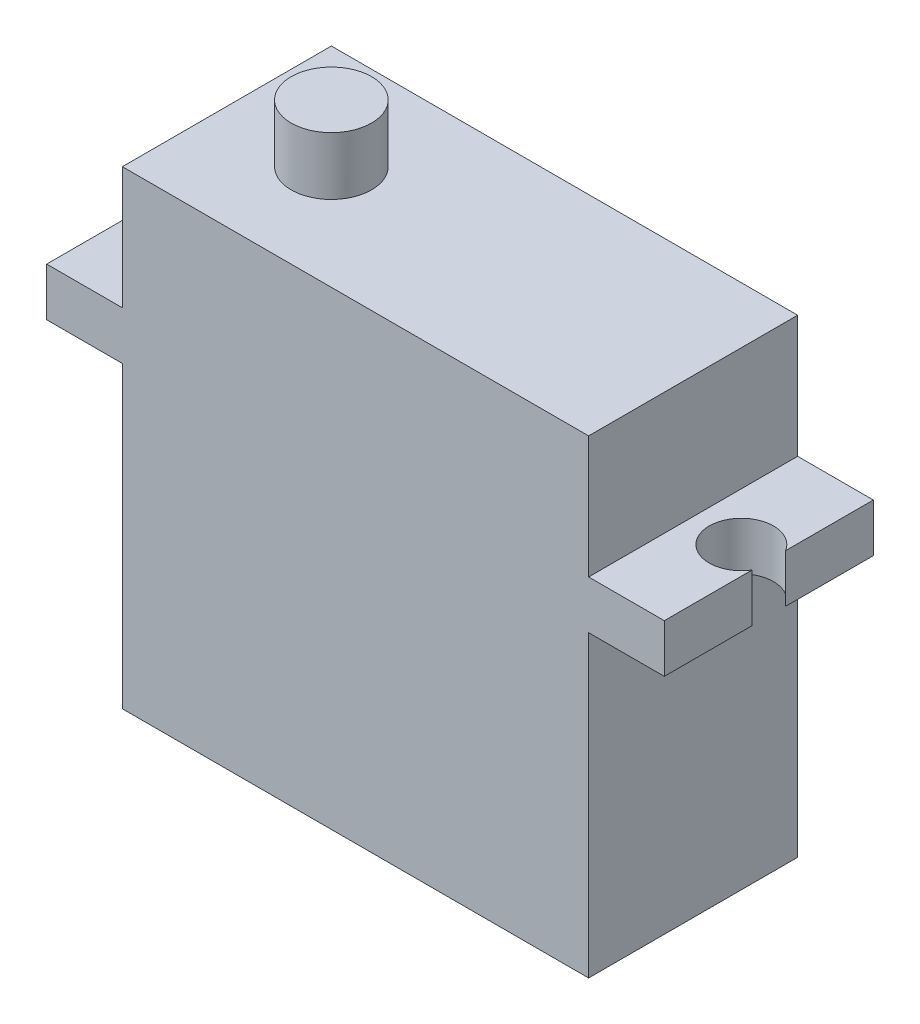
from build123d import *

# Parameters (mm, degrees)
SKETCH_1_W      = 29
SKETCH_1_H      = 13
EXTRUDE_2_DEPTH = 29.2
EXTRUDE_3_DEPTH = 3
SKETCH_3_R      = 2.5
EXTRUDE_4_DEPTH = 3.6


with BuildPart() as part:
    # 草图1 → 凸台-拉伸2 (new body)
    with BuildSketch(Plane(origin=(0, 0, 0), x_dir=(1, 0, 0), z_dir=(0, 1, 0))):
        with Locations((14.5, 6.5)):
            Rectangle(SKETCH_1_W, SKETCH_1_H)
    extrude(amount=EXTRUDE_2_DEPTH)

    # 草图2 → 凸台-拉伸3 (add)
    with BuildSketch(Plane(origin=(0, 18.6, 0), x_dir=(-1, 0, 0), z_dir=(0, -1, 0))):
        with BuildLine():
            Line((-29, 0), (-29, 13))
            Line((-29, 13), (-33.706494839, 13))
            Line((-33.706494839, 13), (-33.706494839, 7.543012639))
            ThreePointArc((-33.706494839, 7.543012639), (-30, 6.5), (-33.706494839, 5.456987361))
            Line((-33.706494839, 5.456987361), (-33.706494839, 0))
            Line((-33.706494839, 0), (-29, 0))
        make_face()
        with BuildLine():
            Line((4.706494839, 13), (0, 13))
            Line((0, 13), (0, 0))
            Line((0, 0), (4.706494839, 0))
            Line((4.706494839, 0), (4.706494839, 5.456987361))
            ThreePointArc((4.706494839, 5.456987361), (1, 6.5), (4.706494839, 7.543012639))
            Line((4.706494839, 7.543012639), (4.706494839, 13))
        make_face()
    extrude(amount=-EXTRUDE_3_DEPTH)

    # 草图3 → 凸台-拉伸4 (add)
    with BuildSketch(Plane(origin=(0, 29.2, 0), x_dir=(1, 0, 0), z_dir=(0, 1, 0))):
        with Locations(Location((6.5, 6.5, 0), (0, 0, 90))):
            Circle(SKETCH_3_R)
    extrude(amount=EXTRUDE_4_DEPTH)


solid = part.part
